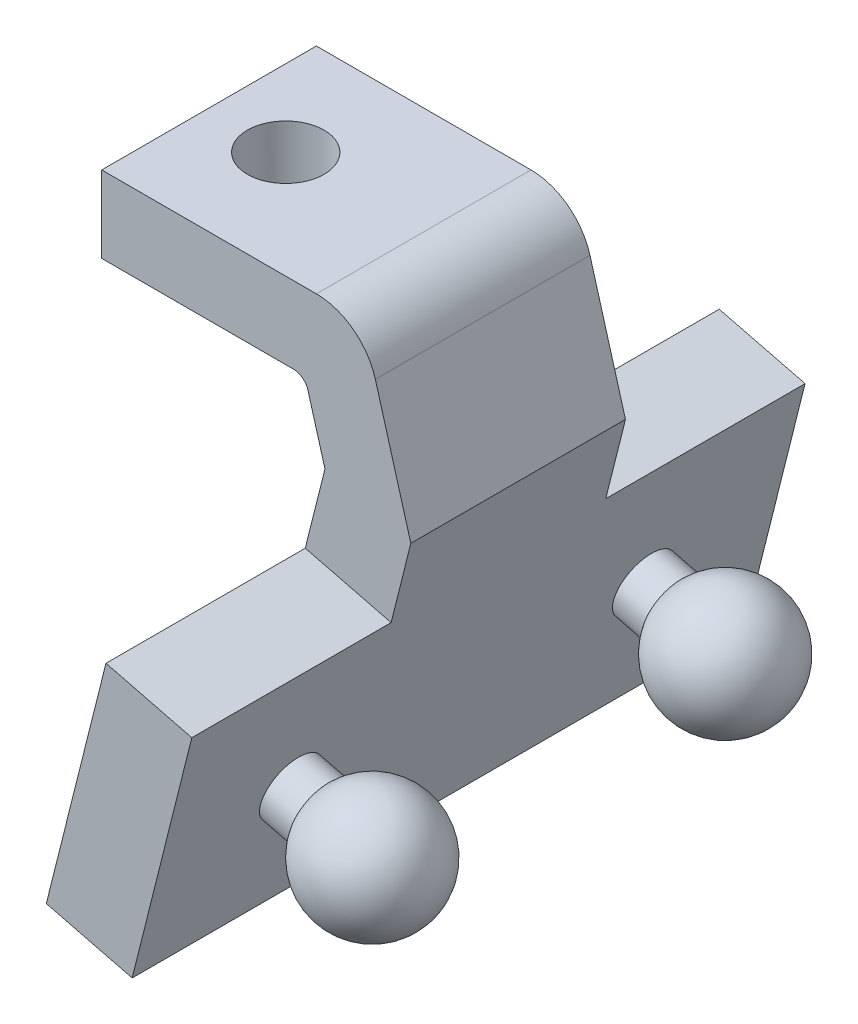
from build123d import *
from build123d.topology import SkipClean

# Parameters (mm, degrees)
EXTRUDE_1_DEPTH     = 3.5
SKETCH_2_R          = 1.25
CUT_EXTRUDE_3_DEPTH = 5.5
SKETCH_3_W          = 20
SKETCH_3_H          = 8
EXTRUDE_2_DEPTH     = 2.886751
SKETCH_4_R          = 1
EXTRUDE_3_DEPTH     = 1


with BuildPart() as part:
    # 草图1 → 凸台-拉伸1 (new, symmetric)
    with BuildSketch(Plane.XY):
        with BuildLine():
            Line((0, 0), (6.245432753, 0))
            ThreePointArc((6.245432753, 0), (6.54659813, -0.100876691), (6.72624124, -0.362802336))
            Line((6.72624124, -0.362802336), (7.280170813, -2.304045596))
            Line((7.280170813, -2.304045596), (4.692818301, -12.624533712))
            Line((4.692818301, -12.624533712), (7.492916275, -13.326519941))
            Line((7.492916275, -13.326519941), (10.080268787, -3.006031824))
            Line((10.080268787, -3.006031824), (8.923233948, 1.048790655))
            ThreePointArc((8.923233948, 1.048790655), (8.204661507, 2.096493237), (7, 2.5))
            Line((7, 2.5), (0, 2.5))
            Line((0, 2.5), (0, 0))
        make_face()
    extrude(amount=EXTRUDE_1_DEPTH, both=True)

    # 草图2 → 切除-拉伸3 (cut)
    with BuildSketch(Plane.XZ):
        with Locations((2.5, 0)):
            Circle(SKETCH_2_R)
    extrude(amount=-CUT_EXTRUDE_3_DEPTH, mode=Mode.SUBTRACT)

    # 草图3 → 凸台-拉伸2 (add)
    with SkipClean():  # the faces are left unmerged after this step: merging them gives an invalid solid
        with BuildSketch(Plane(origin=(10.193230201, -2.555448877, 0), x_dir=(0, 0, -1), z_dir=(0.969982391695105, -0.24317516279719864, 0))):
            with Locations((0, -7.10439855)):
                Rectangle(SKETCH_3_W, SKETCH_3_H)
        extrude(amount=-EXTRUDE_2_DEPTH)

    # 草图4 → 凸台-拉伸3 (add)
    with SkipClean():  # the faces are left unmerged after this step: merging them gives an invalid solid
        with BuildSketch(Plane(origin=(10.193230201, -2.555448877, 0), x_dir=(0, 0, -1), z_dir=(0.969982391695105, -0.24317516279719864, 0))):
            with Locations(Location((-5.754337631, -7.256560167, 0), (0, 0, 270))):
                Circle(SKETCH_4_R)
        extrude_3 = extrude(amount=EXTRUDE_3_DEPTH)

    # 草图5 → 旋转1 (revolve)
    with SkipClean():  # the faces are left unmerged after this step: merging them gives an invalid solid
        with BuildSketch(Plane(origin=(-1.7646152, -7.038735586, 0), x_dir=(-0.969982391695105, 0.24317516279719864, 0), z_dir=(0.24317516279719864, 0.969982391695105, 0))):
            with BuildLine():
                Line((-11.508675506, 5.754337631), (-15.240726313, 5.754337631))
                ThreePointArc((-15.240726313, 5.754337631), (-13.758364403, 7.686189284), (-11.508675506, 6.754337631))
                Line((-11.508675506, 6.754337631), (-11.508675506, 5.754337631))
            make_face()
        revolve_1 = revolve(axis=Axis((9.398597392, -9.837359626, 5.754337631), (0.969982391695105, -0.24317516279719853, 0)))

    # 镜向1: 凸台-拉伸3, 旋转1 across plane
    with SkipClean():  # the faces are left unmerged after this step: merging them gives an invalid solid
        add(extrude_3.mirror(Plane.XY))
        add(revolve_1.mirror(Plane.XY))


solid = part.part
